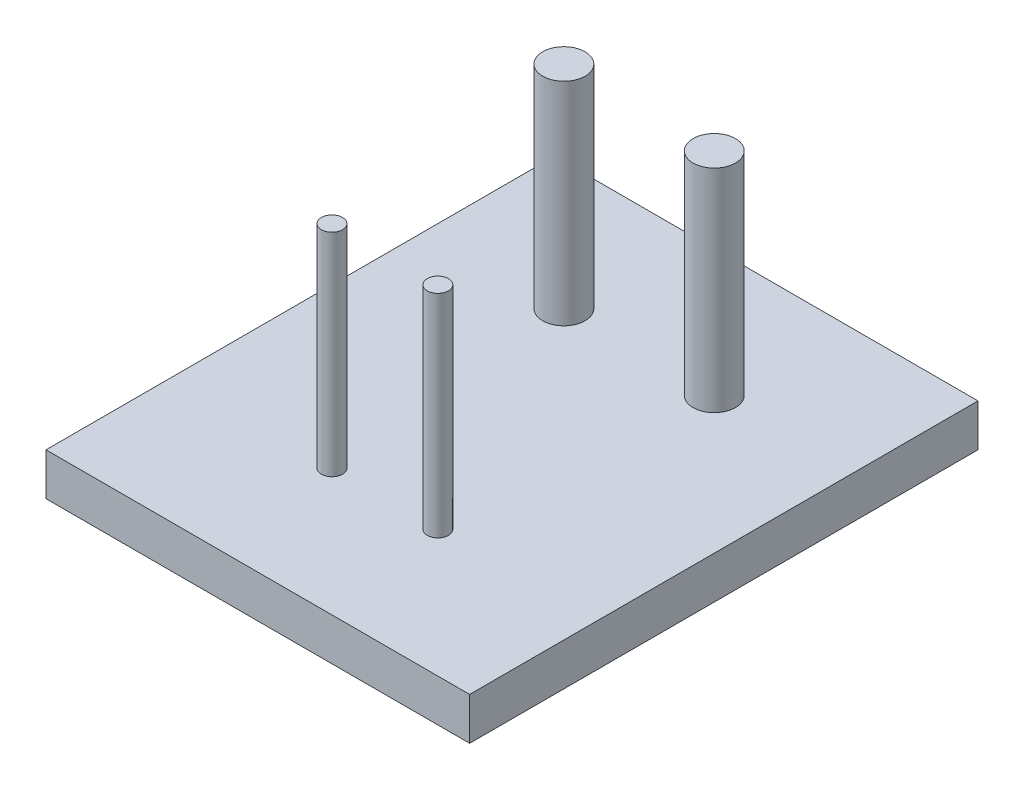
from build123d import *

# Parameters (mm, degrees)
SKETCH1_W           = 100
SKETCH1_H           = 120
BOSS_EXTRUDE1_DEPTH = 5
SKETCH2_R           = 5
SKETCH2_R_2         = 2.5
BOSS_EXTRUDE2_DEPTH = 50


with BuildPart() as part:
    # Sketch1 → Boss-Extrude1 (new, symmetric)
    with BuildSketch(Plane(origin=(0, 0, 0), x_dir=(1, 0, 0), z_dir=(0, 1, 0))):
        Rectangle(SKETCH1_W, SKETCH1_H)
    extrude(amount=BOSS_EXTRUDE1_DEPTH, both=True)

    # Sketch2 → Boss-Extrude2 (add)
    with BuildSketch(Plane(origin=(0, 5, 0), x_dir=(1, 0, 0), z_dir=(0, 1, 0))):
        with Locations(Location((-17.75, 30, 0), (0, 0, 270))):
            Circle(SKETCH2_R)
        with Locations(Location((17.75, 30, 0), (0, 0, 90))):
            Circle(SKETCH2_R)
        with Locations(Location((-12.5, -30, 0), (0, 0, 270))):
            Circle(SKETCH2_R_2)
        with Locations(Location((12.5, -30, 0), (0, 0, 270))):
            Circle(SKETCH2_R_2)
    extrude(amount=BOSS_EXTRUDE2_DEPTH)


solid = part.part
